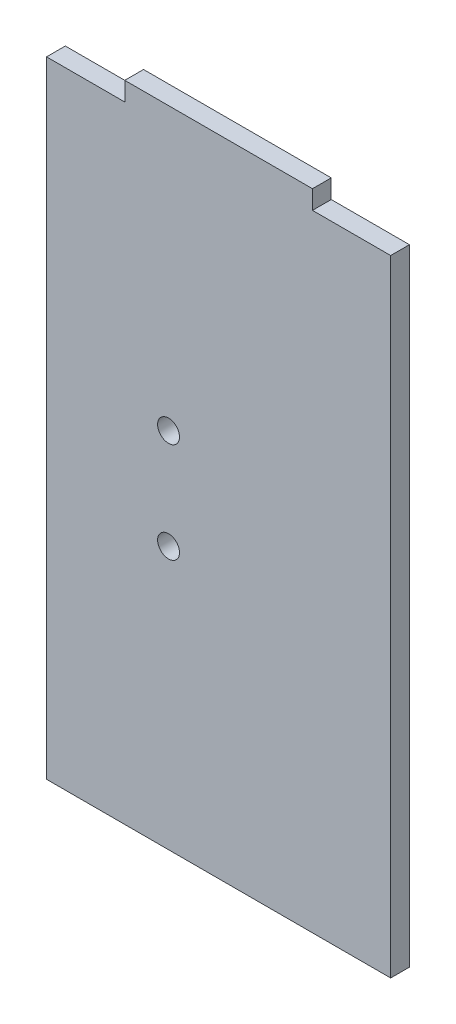
from build123d import *

# Parameters (mm, degrees)
SKETCH_1_W          = 30
SKETCH_1_H          = 3
EXTRUDE_1_DEPTH     = 3
SKETCH_2_R          = 1.75
CUT_EXTRUDE_1_DEPTH = 10


with BuildPart() as part:
    # Эскиз1 → Бобышка-Вытянуть1 (new body)
    with BuildSketch(Plane.XY):
        Polygon((-27.5, 50), (-27.5, -50), (27.5, -50), (27.5, 50), (15, 50), (15, 47), (-15, 47), (-15, 50), align=None)
        with Locations((0, 48.5)):
            Rectangle(SKETCH_1_W, SKETCH_1_H)
        with Locations((0, 51.5)):
            Rectangle(SKETCH_1_W, SKETCH_1_H)
    extrude(amount=EXTRUDE_1_DEPTH)

    # Эскиз2 → Вырез-Вытянуть1 (cut)
    with BuildSketch(Plane.XY.offset(3)):
        with Locations((-8, 8)):
            Circle(SKETCH_2_R)
        with Locations((-8, -8)):
            Circle(SKETCH_2_R)
    extrude(amount=-CUT_EXTRUDE_1_DEPTH, mode=Mode.SUBTRACT)


solid = part.part
